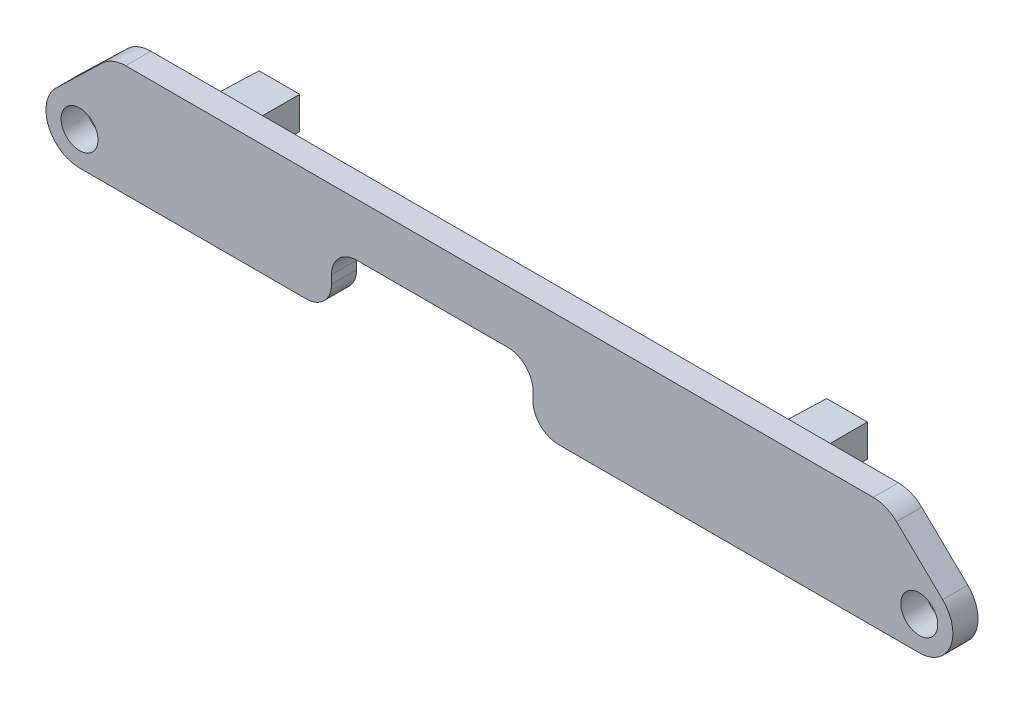
from build123d import *

# Parameters (mm, degrees)
EXTRUDE_1_DEPTH     = 1.5
FILLET_1_R          = 2
SKETCH_2_W          = 12
SKETCH_2_H          = 3.5
CUT_EXTRUDE_1_DEPTH = 1.5
SKETCH_3_W          = 2.5
SKETCH_3_H          = 2
EXTRUDE_2_DEPTH     = 2.3
EXTRUDE_2_TAPER     = 1
HOLE_WIZARD_M2_1_D  = 2.2
FILLET_2_R          = 1.5


with BuildPart() as part:
    # 草图1 → 凸台-拉伸1 (new body)
    with BuildSketch(Plane.XY):
        with BuildLine():
            Line((-25, -3.5), (25, -3.5))
            ThreePointArc((25, -3.5), (26.854367709, -2.249213187), (26.389316741, -0.061320399))
            Line((26.389316741, -0.061320399), (23.06389712, 3.15))
            Line((23.06389712, 3.15), (-23.06389712, 3.15))
            Line((-23.06389712, 3.15), (-26.389316741, -0.061320399))
            ThreePointArc((-26.389316741, -0.061320399), (-26.854367709, -2.249213187), (-25, -3.5))
        make_face()
    extrude(amount=-EXTRUDE_1_DEPTH)

    # 圆角1
    fillet_1_edges = [part.edges().sort_by_distance(p)[0] for p in [
        (-23.06389712, 3.15, -0.75),
        (23.06389712, 3.15, -0.75),
    ]]
    fillet(fillet_1_edges, radius=FILLET_1_R)

    # 草图2 → 切除-拉伸1 (cut)
    with BuildSketch(Plane.XY):
        with Locations((-4, -1.75)):
            Rectangle(SKETCH_2_W, SKETCH_2_H)
    extrude(amount=-CUT_EXTRUDE_1_DEPTH, mode=Mode.SUBTRACT)

    # 草图3 → 凸台-拉伸2 (add)
    with BuildSketch(Plane(origin=(0, 0, -1.5), x_dir=(-1, 0, 0), z_dir=(0, 0, -1))):
        with Locations((16.9, 2.1)):
            Rectangle(SKETCH_3_W, SKETCH_3_H)
    extrude_2 = extrude(amount=EXTRUDE_2_DEPTH, taper=EXTRUDE_2_TAPER)

    # M2 间隙孔1 (through all)
    with Locations(Plane(origin=(0, 0, -1.5), x_dir=(-1, 0, 0), z_dir=(0, 0, -1))):
        with Locations((25, -1.5)):
            hole_wizard_m2_1 = Hole(HOLE_WIZARD_M2_1_D / 2)

    # 镜向1: 凸台-拉伸2, M2 间隙孔1 across plane
    add(extrude_2.mirror(Plane(origin=(0, 0, 0), x_dir=(0, 0, 1), z_dir=(1, 0, 0))))
    add(hole_wizard_m2_1.mirror(Plane(origin=(0, 0, 0), x_dir=(0, 0, 1), z_dir=(1, 0, 0))), mode=Mode.SUBTRACT)

    # 圆角2
    fillet_2_edges = [part.edges().sort_by_distance(p)[0] for p in [
        (2, 0, -0.75),
        (2, -3.5, -0.75),
        (-10, -3.5, -0.75),
        (-10, 0, -0.75),
    ]]
    fillet(fillet_2_edges, radius=FILLET_2_R)


solid = part.part
